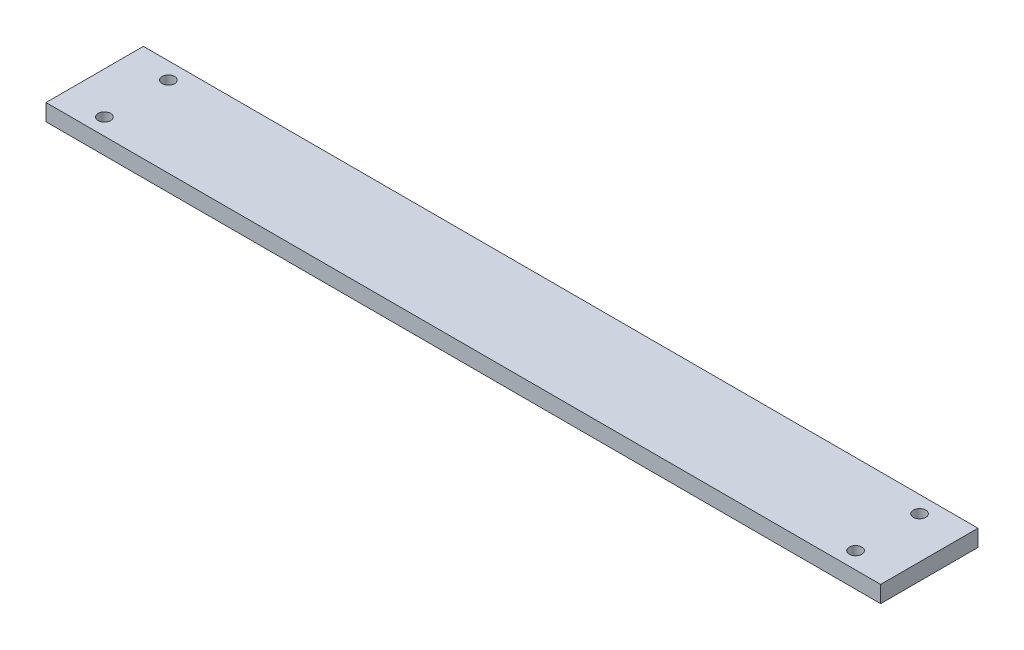
from build123d import *

# Parameters (mm, degrees)
SKETCH_1_W      = 600
SKETCH_1_H      = 70
SKETCH_1_R      = 4.5
EXTRUDE_1_DEPTH = 12


with BuildPart() as part:
    # 草图1 → 凸台-拉伸1 (new body)
    with BuildSketch(Plane(origin=(0, 0, 0), x_dir=(1, 0, 0), z_dir=(0, 1, 0))):
        Rectangle(SKETCH_1_W, SKETCH_1_H)
        with Locations(Location((-270, -23, 0), (0, 0, 270))):
            Circle(SKETCH_1_R, mode=Mode.SUBTRACT)
        with Locations(Location((-270, 23, 0), (0, 0, 270))):
            Circle(SKETCH_1_R, mode=Mode.SUBTRACT)
        with Locations(Location((270, -23, 0), (0, 0, 270))):
            Circle(SKETCH_1_R, mode=Mode.SUBTRACT)
        with Locations(Location((270, 23, 0), (0, 0, 270))):
            Circle(SKETCH_1_R, mode=Mode.SUBTRACT)
    extrude(amount=EXTRUDE_1_DEPTH)


solid = part.part
